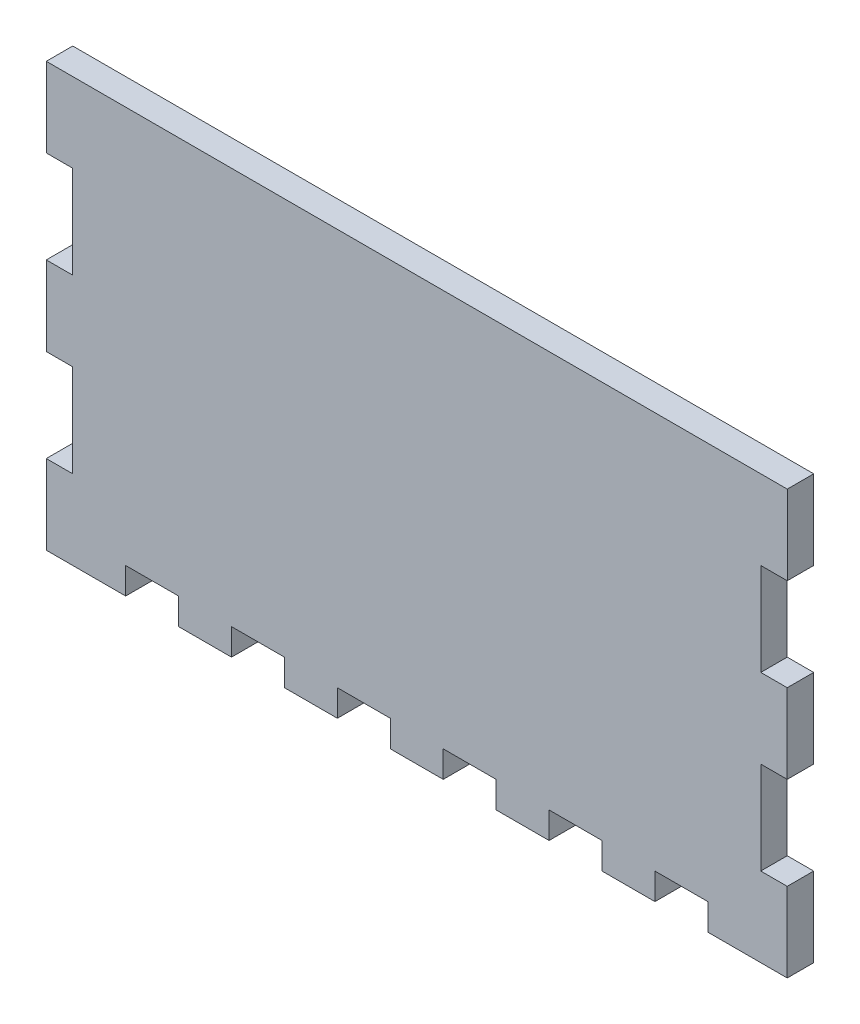
from build123d import *

# Parameters (mm, degrees)
BOSS_EXTRUDE1_DEPTH = 5


with BuildPart() as part:
    # Sketch1 → Boss-Extrude1 (new body)
    with BuildSketch(Plane.XY):
        Polygon((69.038630962, -4.683293815), (64.038630962, -4.683293815), (64.038630962, -22.183293815), (69.038630962, -22.183293815), (69.038630962, -37.183293815), (54.044687612, -37.183293815), (54.044687612, -32.183293815), (44.044687612, -32.183293815), (44.044687612, -37.183293815), (34.044687612, -37.183293815), (34.044687612, -32.183293815), (24.044687612, -32.183293815), (24.044687612, -37.183293815), (14.044687612, -37.183293815), (14.044687612, -32.183293815), (4.044687612, -32.183293815), (4.044687612, -37.183293815), (-5.955312388, -37.183293815), (-5.955312388, -32.183293815), (-15.955312388, -32.183293815), (-15.955312388, -37.183293815), (-25.955312388, -37.183293815), (-25.955312388, -32.183293815), (-35.955312388, -32.183293815), (-35.955312388, -37.183293815), (-45.955312388, -37.183293815), (-45.955312388, -32.183293815), (-55.955312388, -32.183293815), (-55.955312388, -37.183293815), (-70.955312388, -37.183293815), (-70.955312388, -22.183293815), (-65.955312388, -22.183293815), (-65.955312388, -4.683293815), (-70.955312388, -4.683293815), (-70.955312388, 10.316706185), (-65.955312388, 10.316706185), (-65.955312388, 27.816706185), (-70.955312388, 27.816706185), (-70.955312388, 42.816706185), (69.044687612, 42.816706185), (69.044687612, 27.816706185), (64.038630962, 27.816706185), (64.038630962, 10.316706185), (69.038630962, 10.316706185), align=None)
    extrude(amount=BOSS_EXTRUDE1_DEPTH)


solid = part.part
